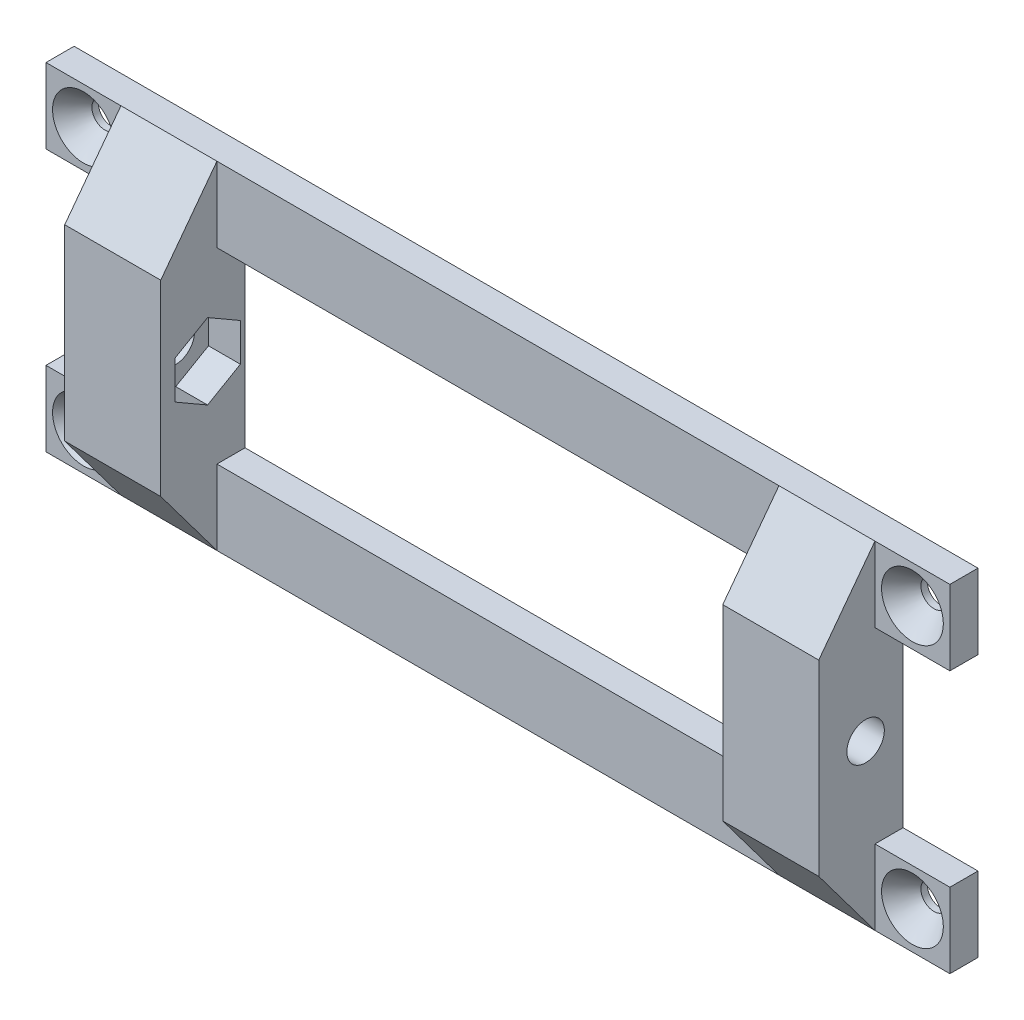
from build123d import *
from OCP.BRepFilletAPI import BRepFilletAPI_MakeChamfer

# Parameters (mm, degrees)
SKETCH_1_W               = 60
SKETCH_1_H               = 20
EXTRUDE_1_DEPTH          = 3
SKETCH_2_W               = 10.25
SKETCH_2_H               = 20
EXTRUDE_2_DEPTH          = 6
CUT_EXTRUDE_1_DEPTH      = 53.278700252
CUT_EXTRUDE_1_DEPTH_BACK = 53.278700252
SKETCH_3_R               = 2
SKETCH_4_R               = 1.4
CUT_EXTRUDE_2_DEPTH      = 53.278700252
EXTRUDE_3_DEPTH          = 10.25
EXTRUDE_4_DEPTH          = 10.25
CUT_EXTRUDE_3_DEPTH      = 3.4
CHAMFER_1_SIZE           = 1.9
CHAMFER_1_SIZE2          = 2.3


with BuildPart() as part:
    # 스케치1 → 보스-돌출1 (new body)
    with BuildSketch(Plane.XY):
        Polygon((-48.25, 18), (48.25, 18), (48.25, 10), (40.25, 10), (40.25, -10), (48.25, -10), (48.25, -18), (-48.25, -18), (-48.25, -10), (-40.25, -10), (-40.25, 10), (-48.25, 10), align=None)
        Rectangle(SKETCH_1_W, SKETCH_1_H, mode=Mode.SUBTRACT)
    extrude(amount=EXTRUDE_1_DEPTH)

    # 스케치2 → 보스-돌출2 (add)
    with BuildSketch(Plane.XY.offset(3)):
        with Locations((35.125, 0)):
            Rectangle(SKETCH_2_W, SKETCH_2_H)
        with Locations((-35.125, 0)):
            Rectangle(SKETCH_2_W, SKETCH_2_H)
    extrude(amount=EXTRUDE_2_DEPTH)

    # 스케치3 → 컷-돌출1 (cut, two sides: drawn at the far end of the back side and taken through both)
    with BuildSketch(Plane(origin=(0, 0, 0), x_dir=(0, 0, -1), z_dir=(1, 0, 0)).offset(-CUT_EXTRUDE_1_DEPTH_BACK)):
        with Locations((-4, 0)):
            Circle(SKETCH_3_R)
    extrude(amount=CUT_EXTRUDE_1_DEPTH + CUT_EXTRUDE_1_DEPTH_BACK, mode=Mode.SUBTRACT)

    # 스케치4 → 컷-돌출2 (cut, through all)
    with BuildSketch(Plane.XY):
        with Locations(Location((44.25, 14, 0), (0, 0, 180))):
            Circle(SKETCH_4_R)
        with Locations(Location((-44.25, 14, 0), (0, 0, 180))):
            Circle(SKETCH_4_R)
        with Locations(Location((44.25, -14, 0), (0, 0, 180))):
            Circle(SKETCH_4_R)
        with Locations(Location((-44.25, -14, 0), (0, 0, 180))):
            Circle(SKETCH_4_R)
    extrude(amount=CUT_EXTRUDE_2_DEPTH, mode=Mode.SUBTRACT)

    # 스케치5 → 보스-돌출3 (add)
    with BuildSketch(Plane(origin=(40.25, 0, 0), x_dir=(0, 0, -1), z_dir=(1, 0, 0))):
        Polygon((-9, 10), (-3, 18), (-3, 10), align=None)
        Polygon((-9, -10), (-3, -10), (-3, -18), align=None)
    extrude(amount=-EXTRUDE_3_DEPTH)

    # 스케치6 → 보스-돌출4 (add)
    with BuildSketch(Plane.ZY.offset(40.25)):
        Polygon((3, 18), (3, 10), (9, 10), align=None)
        Polygon((3, -10), (3, -18), (9, -10), align=None)
    extrude(amount=-EXTRUDE_4_DEPTH)

    # 스케치7 → 컷-돌출3 (cut)
    with BuildSketch(Plane.ZY.offset(-30)):
        Polygon((4, 4.041451884), (0.5, 2.020725942), (0.5, -2.020725942), (4, -4.041451884), (7.5, -2.020725942), (7.5, 2.020725942), align=None)
    cut_extrude_3 = extrude(amount=-CUT_EXTRUDE_3_DEPTH, mode=Mode.SUBTRACT)

    # 대칭 복사2: 컷-돌출3 across plane
    add(cut_extrude_3.mirror(Plane(origin=(0, 0, 0), x_dir=(0, 0, 1), z_dir=(1, 0, 0))), mode=Mode.SUBTRACT)

    # 모따기1: one chamfer whose edges measure the first distance from different faces: ONE call of the kernel's chamfer builder (chamfer() names one face for all edges)
    chamfer_1_edges_1 = [part.edges().sort_by_distance(p)[0] for p in [
        (45.65, -14, 3),
    ]]
    chamfer_1_side_1 = [part.faces().sort_by_distance(p)[0] for p in [
        (44.25, -17.886862915, 3),
    ]]
    chamfer_1_edges_2 = [part.edges().sort_by_distance(p)[0] for p in [
        (-42.85, -14, 3),
    ]]
    chamfer_1_side_2 = [part.faces().sort_by_distance(p)[0] for p in [
        (-44.25, -17.886862915, 3),
    ]]
    chamfer_1_edges_3 = [part.edges().sort_by_distance(p)[0] for p in [
        (45.65, 14, 3),
    ]]
    chamfer_1_side_3 = [part.faces().sort_by_distance(p)[0] for p in [
        (40.363137085, 14, 3),
    ]]
    chamfer_1_edges_4 = [part.edges().sort_by_distance(p)[0] for p in [
        (-42.85, 14, 3),
    ]]
    chamfer_1_side_4 = [part.faces().sort_by_distance(p)[0] for p in [
        (-40.363137085, 14, 3),
    ]]
    chamfer_1 = BRepFilletAPI_MakeChamfer(part.part.solid().wrapped)
    for e in chamfer_1_edges_1:
        chamfer_1.Add(CHAMFER_1_SIZE, CHAMFER_1_SIZE2, e.wrapped, chamfer_1_side_1[0].wrapped)  # the first distance lies on this face
    for e in chamfer_1_edges_2:
        chamfer_1.Add(CHAMFER_1_SIZE, CHAMFER_1_SIZE2, e.wrapped, chamfer_1_side_2[0].wrapped)  # the first distance lies on this face
    for e in chamfer_1_edges_3:
        chamfer_1.Add(CHAMFER_1_SIZE, CHAMFER_1_SIZE2, e.wrapped, chamfer_1_side_3[0].wrapped)  # the first distance lies on this face
    for e in chamfer_1_edges_4:
        chamfer_1.Add(CHAMFER_1_SIZE, CHAMFER_1_SIZE2, e.wrapped, chamfer_1_side_4[0].wrapped)  # the first distance lies on this face
    add(Compound.cast(chamfer_1.Shape()), mode=Mode.REPLACE)


solid = part.part
